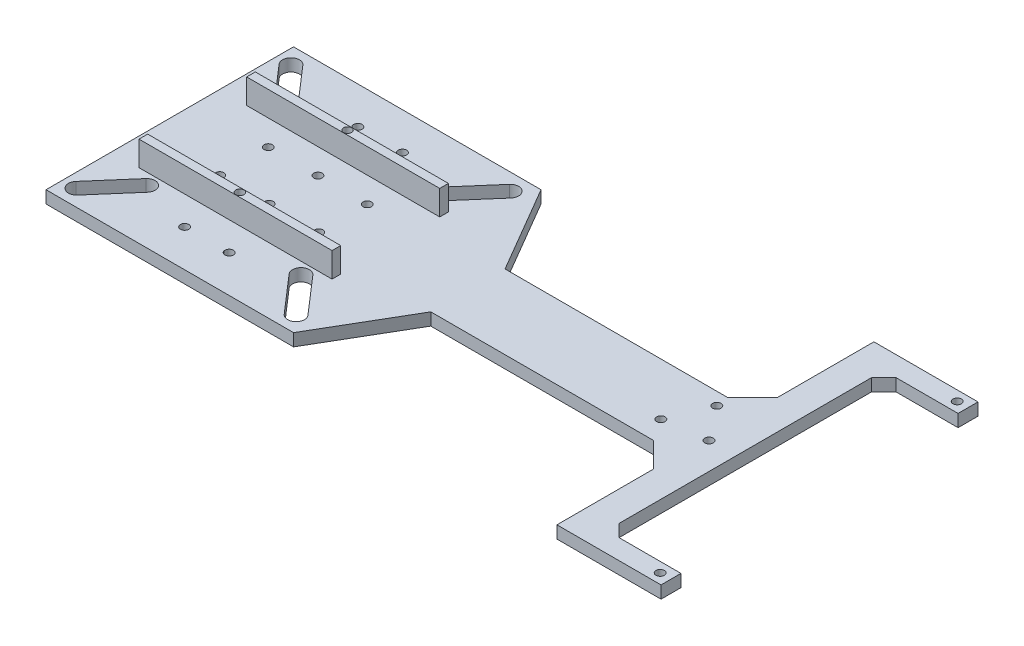
from build123d import *

# Parameters (mm, degrees)
SKETCH1_R           = 1.7
BOSS_EXTRUDE3_DEPTH = 5
SKETCH5_W           = 78
SKETCH5_H           = 3.5
BOSS_EXTRUDE4_DEPTH = 10
SKETCH6_R           = 1.65
SKETCH6_R_2         = 1.7
CUT_EXTRUDE5_DEPTH  = 225.037103934
SKETCH8_R           = 1.65
CUT_EXTRUDE6_DEPTH  = 10
SKETCH9_R           = 1.7
CUT_EXTRUDE8_DEPTH  = 225.037103934


with BuildPart() as part:
    # Sketch1 → Boss-Extrude3 (new body)
    with BuildSketch(Plane(origin=(0, 0, 0), x_dir=(1, 0, 0), z_dir=(0, 1, 0))):
        Polygon((137.5, 44.585264028), (137.5, 5.555589367), (149.554092402, 5.555589367), (179.554092402, 5.555589367), (179.554092402, 13.614938689), (154.554092402, 13.614938689), (149.554092402, 18.614938689), (149.554092402, 120.555589367), (154.554092402, 125.555589367), (179.554092402, 125.555589367), (179.554092402, 133.614938689), (149.554092402, 133.614938689), (137.5, 133.614938689), (137.5, 94.585264028), (127.5, 84.585264028), (37.5, 84.585264028), (17.045454545, 119.585264028), (-82.954545455, 119.585264028), (-82.954545455, 19.585264028), (17.045454545, 19.585264028), (37.5, 54.585264028), (127.5, 54.585264028), align=None)
        with Locations(Location((138.726505033, 65.770964076, 0), (0, 0, 270))):
            Circle(SKETCH1_R, mode=Mode.SUBTRACT)
        with Locations(Location((121.557258463, 63.486894852, 0), (0, 0, 270))):
            Circle(SKETCH1_R, mode=Mode.SUBTRACT)
        with Locations(Location((128.163819776, 79.497933157, 0), (0, 0, 270))):
            Circle(SKETCH1_R, mode=Mode.SUBTRACT)
        with Locations(Location((175.173925842, 9.585264028, 0), (0, 0, 270))):
            Circle(SKETCH1_R, mode=Mode.SUBTRACT)
        with Locations(Location((175.173925842, 129.585264028, 0), (0, 0, 90))):
            Circle(SKETCH1_R, mode=Mode.SUBTRACT)
        with BuildLine():
            Line((-79.802677261, 28.560822148), (-66.688486942, 43.661087452))
            ThreePointArc((-66.688486942, 43.661087452), (-61.892029486, 43.998720199), (-61.554396738, 39.202262743))
            Line((-61.554396738, 39.202262743), (-74.668587058, 24.101997439))
            ThreePointArc((-74.668587058, 24.101997439), (-79.465044514, 23.764364691), (-79.802677261, 28.560822148))
        make_face(mode=Mode.SUBTRACT)
        with BuildLine():
            Line((-79.802677261, 110.609705909), (-66.688486942, 95.509440605))
            ThreePointArc((-66.688486942, 95.509440605), (-61.892029486, 95.171807858), (-61.554396738, 99.968265314))
            Line((-61.554396738, 99.968265314), (-74.668587058, 115.068530618))
            ThreePointArc((-74.668587058, 115.068530618), (-79.465044514, 115.406163365), (-79.802677261, 110.609705909))
        make_face(mode=Mode.SUBTRACT)
        with BuildLine():
            Line((13.893586352, 110.609705909), (0.779396033, 95.509440605))
            ThreePointArc((0.779396033, 95.509440605), (-4.017061423, 95.171807858), (-4.354694171, 99.968265314))
            Line((-4.354694171, 99.968265314), (8.759496149, 115.068530618))
            ThreePointArc((8.759496149, 115.068530618), (13.555953605, 115.406163365), (13.893586352, 110.609705909))
        make_face(mode=Mode.SUBTRACT)
        with BuildLine():
            Line((13.893586352, 28.560822148), (0.779396033, 43.661087452))
            ThreePointArc((0.779396033, 43.661087452), (-4.017061423, 43.998720199), (-4.354694171, 39.202262743))
            Line((-4.354694171, 39.202262743), (8.759496149, 24.101997439))
            ThreePointArc((8.759496149, 24.101997439), (13.555953605, 23.764364691), (13.893586352, 28.560822148))
        make_face(mode=Mode.SUBTRACT)
    extrude(amount=BOSS_EXTRUDE3_DEPTH)

    # Sketch5 → Boss-Extrude4 (add)
    with BuildSketch(Plane(origin=(0, 5, 0), x_dir=(1, 0, 0), z_dir=(0, 1, 0))):
        with Locations((-32.885058048, 47.835264028)):
            Rectangle(SKETCH5_W, SKETCH5_H)
        with Locations((-32.885058048, 91.335264028)):
            Rectangle(SKETCH5_W, SKETCH5_H)
    extrude(amount=BOSS_EXTRUDE4_DEPTH)

    # Sketch6 → Cut-Extrude5 (cut, through all)
    with BuildSketch(Plane(origin=(0, 5, 0), x_dir=(1, 0, 0), z_dir=(0, 1, 0))):
        with Locations(Location((-32.954545455, 47.824855797, 0), (0, 0, 270))):
            Circle(SKETCH6_R)
        with Locations(Location((-32.954545455, 59.701124199, 0), (0, 0, 270))):
            Circle(SKETCH6_R_2)
        with Locations(Location((-12.954545455, 59.791818088, 0), (0, 0, 270))):
            Circle(SKETCH6_R_2)
        with Locations(Location((-52.954545455, 59.791818088, 0), (0, 0, 270))):
            Circle(SKETCH6_R_2)
        with Locations(Location((-32.954545455, 91.34567226, 0), (0, 0, 90))):
            Circle(SKETCH6_R)
        with Locations(Location((-12.954545455, 79.378709969, 0), (0, 0, 90))):
            Circle(SKETCH6_R_2)
        with Locations(Location((-32.954545455, 79.469403858, 0), (0, 0, 90))):
            Circle(SKETCH6_R_2)
        with Locations(Location((-52.954545455, 79.378709969, 0), (0, 0, 90))):
            Circle(SKETCH6_R_2)
    extrude(amount=-CUT_EXTRUDE5_DEPTH, mode=Mode.SUBTRACT)

    # Sketch8 → Cut-Extrude6 (cut)
    with BuildSketch(Plane(origin=(0, 15, 0), x_dir=(1, 0, 0), z_dir=(0, 1, 0))):
        with Locations(Location((-32.885058048, 47.835264028, 0), (0, 0, 270))):
            Circle(SKETCH8_R)
        with Locations(Location((-32.885058048, 91.335264028, 0), (0, 0, 260.261217373))):
            Circle(SKETCH8_R)
    extrude(amount=-CUT_EXTRUDE6_DEPTH, mode=Mode.SUBTRACT)

    # Sketch9 → Cut-Extrude8 (cut, through all)
    with BuildSketch(Plane(origin=(0, 5, 0), x_dir=(1, 0, 0), z_dir=(0, 1, 0))):
        with Locations(Location((-23.954545455, 34.585264028, 0), (0, 0, 270))):
            Circle(SKETCH9_R)
        with Locations(Location((-41.954545455, 34.585264028, 0), (0, 0, 90))):
            Circle(SKETCH9_R)
        with Locations(Location((-41.954545455, 104.585264028, 0), (0, 0, 270))):
            Circle(SKETCH9_R)
        with Locations(Location((-23.954545455, 104.585264028, 0), (0, 0, 90))):
            Circle(SKETCH9_R)
    extrude(amount=-CUT_EXTRUDE8_DEPTH, mode=Mode.SUBTRACT)


solid = part.part
